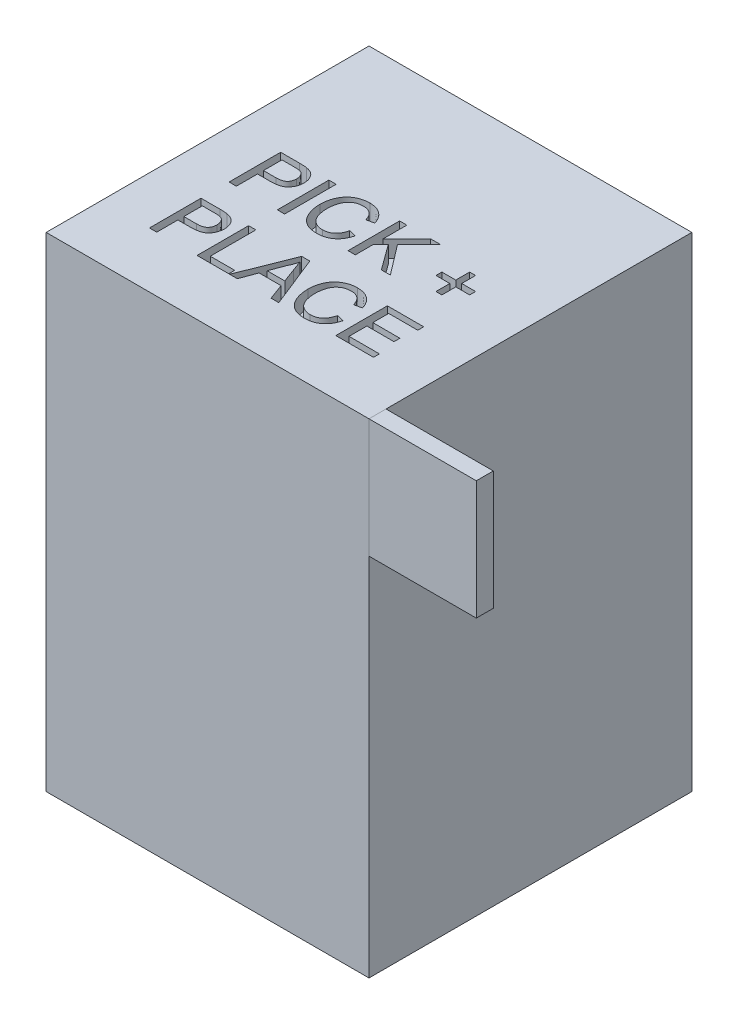
from build123d import *

# Parameters (mm, degrees)
SKETCH1_W           = 965.2
SKETCH1_H           = 965.2
BOSS_EXTRUDE1_DEPTH = 1447.8
SKETCH2_W           = 21.731927333
SKETCH2_H           = 154.099121094
CUT_EXTRUDE1_DEPTH  = 50.8
SKETCH3_W           = 50.8
SKETCH3_H           = 355.6
BOSS_EXTRUDE2_DEPTH = 320.802


with BuildPart() as part:
    # Sketch1 → Boss-Extrude1 (new body)
    with BuildSketch(Plane(origin=(0, 0, 0), x_dir=(1, 0, 0), z_dir=(0, 1, 0))):
        Rectangle(SKETCH1_W, SKETCH1_H)
    extrude(amount=BOSS_EXTRUDE1_DEPTH)

    # Sketch2 → Cut-Extrude1 (cut)
    # profile 1 of 10: a face of its own
    with BuildSketch(Plane(origin=(0, 1447.8, 0), x_dir=(1, 0, 0), z_dir=(0, 1, 0))):
        with BuildLine():
            Line((-339.627755427, -78.624535258), (-339.627755427, 75.474585836))
            Line((-339.627755427, 75.474585836), (-283.013615185, 75.474585836))
            add(Edge.make_bspline(
                [(-283.013615185, 75.474585836), (-280.667004704, 75.461217004), (-276.260059214, 75.436110275), (-270.105816457, 75.142078196), (-264.821068254, 74.778311845), (-261.629059109, 74.260403174), (-260.170396113, 74.023732733)],
                knots=[0, 0, 0, 0, 1.22865052, 2.30741144, 3.226532197, 4, 4, 4, 4], degree=3))
            add(Edge.make_bspline(
                [(-260.170396113, 74.023732733), (-258.391179385, 73.681318496), (-254.942561415, 73.017624258), (-250.059852894, 71.41760142), (-245.61142258, 69.426495139), (-241.604222517, 66.945782167), (-237.971680731, 64.031551212), (-234.765565087, 60.539618429), (-231.923585551, 56.547952525), (-229.507034816, 52.059676746), (-227.495626597, 47.230293933), (-226.086828435, 42.085330183), (-225.184490675, 36.714172238), (-225.08951363, 33.043399002), (-225.041229486, 31.177262364)],
                knots=[0, 0, 0, 0, 1.070909925, 2.075721949, 3.031861647, 3.947440733, 4.85625699, 5.777986723, 6.742441087, 7.747548058, 8.78749499, 9.830146138, 10.896896232, 12, 12, 12, 12], degree=3))
            add(Edge.make_bspline(
                [(-225.041229486, 31.177262364), (-225.075257318, 29.580596552), (-225.142208943, 26.439069099), (-225.717111925, 21.823711888), (-226.623858219, 17.383550595), (-227.976393279, 13.148969934), (-229.629903724, 9.070463497), (-231.713708962, 5.216816267), (-234.147005557, 1.535698965), (-236.938751888, -1.962871767), (-240.225412673, -5.207901957), (-244.179669639, -7.960672101), (-248.725284333, -10.272225205), (-253.863316931, -12.139935113), (-259.581294747, -13.609521844), (-265.897952926, -14.686267139), (-272.825596491, -15.28072015), (-277.641257972, -15.36210647), (-280.142778194, -15.404383014)],
                knots=[0, 0, 0, 0, 0.928769099, 1.82740408, 2.702266355, 3.562020322, 4.410419678, 5.259600434, 6.10654066, 6.975254961, 7.860221694, 8.783881459, 9.766664779, 10.81996744, 11.958551584, 13.197863772, 14.544415867, 16, 16, 16, 16], degree=3))
            Line((-280.142778194, -15.404383014), (-317.895828093, -15.404383014))
            Line((-317.895828093, -15.404383014), (-317.895828093, -78.624535258))
            Line((-317.895828093, -78.624535258), (-339.627755427, -78.624535258))
        make_face()
        with BuildLine():
            Line((-317.895828093, 2.376284804), (-280.729293278, 2.376284804))
            add(Edge.make_bspline(
                [(-280.729293278, 2.376284804), (-279.246945821, 2.401070217), (-276.391340822, 2.448817017), (-272.265121837, 2.782020128), (-268.478270976, 3.358779353), (-265.020283853, 4.163189613), (-261.886757326, 5.163048478), (-259.083297921, 6.427594734), (-256.6243622, 7.944489824), (-254.493656638, 9.698276451), (-252.66468637, 11.662945346), (-251.079927111, 13.806290672), (-249.733429983, 16.143629063), (-248.677935353, 18.684739731), (-247.78378588, 21.38019313), (-247.225675185, 24.285839229), (-246.837622573, 27.359541892), (-246.794946698, 29.478141928), (-246.773156819, 30.559878065)],
                knots=[0, 0, 0, 0, 1.403696362, 2.704090955, 3.91683431, 5.027708188, 6.063065288, 7.026749679, 7.932587242, 8.790956304, 9.632005367, 10.468072405, 11.310475089, 12.179234342, 13.069796908, 13.994719932, 14.976123913, 16, 16, 16, 16], degree=3))
            add(Edge.make_bspline(
                [(-246.773156819, 30.559878065), (-246.81919091, 32.128567993), (-246.908388905, 35.168141378), (-247.807080916, 39.541993877), (-249.21604013, 43.583511137), (-251.233255093, 47.216174503), (-253.674671953, 50.402987814), (-256.544505729, 53.010325668), (-259.750748759, 55.094796191), (-262.144682294, 55.920144865), (-263.349925254, 56.335672559)],
                knots=[0, 0, 0, 0, 1.143156811, 2.215038775, 3.243253804, 4.254666983, 5.233799895, 6.158487526, 7.072877374, 8, 8, 8, 8], degree=3))
            add(Edge.make_bspline(
                [(-263.349925254, 56.335672559), (-263.79132385, 56.443604269), (-264.750513348, 56.678147295), (-266.33940324, 56.944357165), (-268.180842911, 57.196434266), (-270.28380846, 57.36367569), (-272.629121366, 57.529767704), (-275.223951545, 57.606331985), (-278.074209951, 57.672461694), (-280.060407528, 57.686547399), (-281.099723858, 57.693918017)],
                knots=[0, 0, 0, 0, 0.611063981, 1.327884044, 2.165719042, 3.110592661, 4.16481496, 5.328235826, 6.601947678, 8, 8, 8, 8], degree=3))
            Line((-281.099723858, 57.693918017), (-317.895828093, 57.693918017))
            Line((-317.895828093, 57.693918017), (-317.895828093, 2.376284804))
        make_face(mode=Mode.SUBTRACT)
    # profile 2 of 10: a face of its own
    with BuildSketch(Plane(origin=(0, 1447.8, 0), x_dir=(1, 0, 0), z_dir=(0, 1, 0))):
        with Locations((-184.540819455, -1.574974711)):
            Rectangle(SKETCH2_W, SKETCH2_H)
    # profile 3 of 10: a face of its own
    with BuildSketch(Plane(origin=(0, 1447.8, 0), x_dir=(1, 0, 0), z_dir=(0, 1, 0))):
        with BuildLine():
            Line((-33.405142997, -24.232978494), (-11.673215663, -29.295529748))
            add(Edge.make_bspline(
                [(-11.673215663, -29.295529748), (-12.217661107, -31.332402926), (-13.282663967, -35.316779669), (-15.38830399, -41.018863833), (-17.751626685, -46.370026598), (-20.42997696, -51.356172049), (-23.452669114, -55.948632949), (-26.739614015, -60.206431278), (-30.421002924, -64.040276976), (-34.361761285, -67.538653203), (-38.592572201, -70.624211699), (-43.062426589, -73.288648066), (-47.749718135, -75.555542558), (-52.673391408, -77.419697395), (-57.836638471, -78.822633738), (-63.212873678, -79.845175936), (-68.817773778, -80.475002375), (-72.638265877, -80.557920878), (-74.584675757, -80.600165016)],
                knots=[0, 0, 0, 0, 1.145254194, 2.240259345, 3.299159039, 4.322497661, 5.312016644, 6.284080175, 7.241264552, 8.196044782, 9.144516039, 10.082428046, 11.020306713, 11.970622414, 12.939253955, 13.924100776, 14.94240044, 16, 16, 16, 16], degree=3))
            add(Edge.make_bspline(
                [(-74.584675757, -80.600165016), (-76.581729995, -80.571151403), (-80.488807024, -80.514388589), (-86.212449617, -80.052694943), (-91.656195758, -79.251959163), (-96.809879373, -78.139451395), (-101.69084715, -76.763904701), (-106.278859044, -75.03334507), (-110.565878996, -72.960259131), (-114.587666447, -70.602624647), (-118.327139496, -67.924245707), (-121.869335065, -64.997404478), (-125.128260424, -61.741528255), (-128.185401032, -58.233491295), (-130.974171256, -54.427017717), (-133.597170561, -50.373820064), (-135.926371862, -46.002481162), (-138.048093561, -41.394045748), (-139.910374046, -36.593131755), (-141.557840885, -31.694570495), (-142.904735091, -26.688601058), (-144.064324086, -21.617347805), (-144.906709304, -16.438139626), (-145.575537086, -11.189836433), (-145.943272047, -5.840261587), (-145.991662088, -2.24431643), (-146.016039181, -0.432813757)],
                knots=[0, 0, 0, 0, 1.180702053, 2.309949215, 3.392367133, 4.431746864, 5.425408375, 6.388154007, 7.326956194, 8.237882283, 9.141054626, 10.043899035, 10.951650021, 11.86168169, 12.792564695, 13.739356664, 14.713891418, 15.718426911, 16.737522708, 17.757217648, 18.772674716, 19.801476837, 20.831699174, 21.873853055, 22.928926693, 24, 24, 24, 24], degree=3))
            add(Edge.make_bspline(
                [(-146.016039181, -0.432813757), (-145.981174803, 1.522776426), (-145.912291598, 5.386528702), (-145.523447021, 11.087607339), (-144.809280478, 16.589845663), (-143.817510877, 21.896862928), (-142.562525568, 27.012957056), (-141.013386882, 31.940620586), (-139.189691359, 36.673548625), (-137.096998827, 41.216960174), (-134.721405809, 45.520138779), (-132.133814037, 49.589201758), (-129.272499511, 53.357336907), (-126.22229595, 56.896535485), (-122.907022477, 60.147865863), (-119.336802478, 63.118693066), (-115.542438293, 65.836114804), (-111.524483755, 68.274903628), (-107.335458209, 70.414813221), (-103.037582166, 72.320849342), (-98.613761147, 73.883105036), (-94.099068453, 75.182057844), (-89.483784361, 76.216144946), (-84.757124759, 76.907642216), (-79.923457156, 77.358275414), (-76.66422095, 77.419347033), (-75.016844767, 77.450215593)],
                knots=[0, 0, 0, 0, 1.185634383, 2.342514083, 3.462112933, 4.547331452, 5.613960142, 6.653690668, 7.676612054, 8.686959706, 9.683658101, 10.654407272, 11.607580201, 12.5494388, 13.484601218, 14.419076806, 15.362504069, 16.311442244, 17.265594461, 18.212500624, 19.159571152, 20.107257795, 21.059246075, 22.024387127, 23.001429356, 24, 24, 24, 24], degree=3))
            add(Edge.make_bspline(
                [(-75.016844767, 77.450215593), (-73.173652746, 77.415472336), (-69.550676326, 77.347181023), (-64.23460392, 76.785471502), (-59.14319455, 75.844669586), (-54.254386225, 74.610426443), (-49.619006971, 72.920490655), (-45.186731743, 70.91135123), (-41.001652904, 68.497613586), (-37.031206968, 65.745611596), (-33.3400267, 62.650269927), (-29.876457954, 59.285535443), (-26.781726868, 55.567314328), (-23.933263279, 51.585594159), (-21.420689348, 47.285162064), (-19.151570024, 42.703513194), (-17.200193447, 37.806588227), (-16.156109795, 34.395744539), (-15.624475179, 32.658984683)],
                knots=[0, 0, 0, 0, 1.098391872, 2.158997981, 3.181470371, 4.182549255, 5.160268219, 6.118029851, 7.079534476, 8.035645336, 8.993622929, 9.94770573, 10.909620999, 11.872786677, 12.862530088, 13.874594564, 14.917769567, 16, 16, 16, 16], degree=3))
            Line((-15.624475179, 32.658984683), (-37.356402512, 27.997733223))
            add(Edge.make_bspline(
                [(-37.356402512, 27.997733223), (-37.783183643, 29.330607241), (-38.618526369, 31.939454108), (-40.101759092, 35.657524534), (-41.70360098, 39.109108649), (-43.462209222, 42.270744138), (-45.38139509, 45.143188304), (-47.416964833, 47.761351437), (-49.617688662, 50.076365121), (-51.938802014, 52.141607815), (-54.440242852, 53.900996955), (-57.063366539, 55.460105271), (-59.863481607, 56.750029651), (-62.800306337, 57.841039202), (-65.901290919, 58.67141503), (-69.153807731, 59.255617181), (-72.560714511, 59.593724765), (-74.882330127, 59.643938049), (-76.066398076, 59.669547775)],
                knots=[0, 0, 0, 0, 1.235697765, 2.418642872, 3.532555292, 4.594392283, 5.610119701, 6.580908344, 7.519430642, 8.427315627, 9.319973334, 10.216139639, 11.118687699, 12.038725643, 12.980015607, 13.949697744, 14.954307006, 16, 16, 16, 16], degree=3))
            add(Edge.make_bspline(
                [(-76.066398076, 59.669547775), (-77.425816403, 59.649823965), (-80.099391077, 59.611033052), (-84.027193901, 59.186470812), (-87.799250762, 58.561132062), (-91.387448648, 57.623382849), (-94.811422436, 56.454253436), (-98.050853664, 54.998480455), (-101.133298377, 53.292143759), (-104.024354922, 51.324996589), (-106.699726584, 49.113544589), (-109.232015205, 46.775693813), (-111.499642837, 44.202412241), (-113.589080912, 41.478551159), (-115.439485066, 38.555977967), (-117.105158778, 35.474501652), (-118.575484649, 32.208867096), (-120.178239689, 27.612733805), (-121.81246327, 21.693020421), (-123.230154242, 14.449209925), (-124.133189968, 7.09127369), (-124.233698181, 2.142191678), (-124.284111847, -0.340206113)],
                knots=[0, 0, 0, 0, 0.935256702, 1.839373932, 2.716087708, 3.564631604, 4.388828665, 5.203538865, 6.005592122, 6.810952829, 7.606223804, 8.392839071, 9.180346482, 9.963639178, 10.753404291, 11.558266631, 12.372976832, 13.215232055, 14.905983541, 16.594894834, 18.292041732, 20, 20, 20, 20], degree=3))
            add(Edge.make_bspline(
                [(-124.284111847, -0.340206113), (-124.227252387, -3.461405905), (-124.116939885, -9.516816156), (-123.028426628, -18.292105841), (-121.368838899, -26.477089068), (-119.36595561, -32.863006836), (-117.356862432, -37.573380017), (-115.732008818, -40.872122288), (-113.877303239, -43.924618353), (-111.838878984, -46.748203712), (-109.590479008, -49.334642046), (-107.163428074, -51.6976727), (-104.557184047, -53.860033591), (-101.740865354, -55.720500676), (-98.822875642, -57.372433218), (-95.84003759, -58.841363181), (-92.79047317, -60.08371913), (-89.661878679, -61.048806463), (-86.498187952, -61.88277609), (-83.264556196, -62.427564193), (-79.961905517, -62.735025433), (-77.744257247, -62.791114183), (-76.622043945, -62.819497197)],
                knots=[0, 0, 0, 0, 2.10686522, 4.087509323, 5.961373225, 7.741398778, 8.594514555, 9.418024779, 10.222433421, 11.003575649, 11.767087398, 12.533660211, 13.289033706, 14.050297079, 14.809623433, 15.552362432, 16.294320901, 17.0305302, 17.761969017, 18.502233515, 19.242073914, 20, 20, 20, 20], degree=3))
            add(Edge.make_bspline(
                [(-76.622043945, -62.819497197), (-75.28283603, -62.79141119), (-72.637426869, -62.735931396), (-68.758921135, -62.250313634), (-65.020095076, -61.534692342), (-61.466244047, -60.430416428), (-58.049564733, -59.07835995), (-54.79805097, -57.411037852), (-51.721928264, -55.405736005), (-48.785014651, -53.128904117), (-46.041469413, -50.538258508), (-43.527157695, -47.654670675), (-41.271536006, -44.464994765), (-39.180007086, -41.020420419), (-37.42273839, -37.218045479), (-35.795092653, -33.171202004), (-34.438820647, -28.813376525), (-33.754651855, -25.781710522), (-33.405142997, -24.232978494)],
                knots=[0, 0, 0, 0, 1.013374089, 2.001772144, 2.95501459, 3.891367103, 4.814208647, 5.733921849, 6.652182523, 7.590185968, 8.54346024, 9.504121027, 10.481158517, 11.497760682, 12.549996529, 13.647863555, 14.798406869, 16, 16, 16, 16], degree=3))
        make_face()
    # profile 4 of 10: a face of its own
    with BuildSketch(Plane(origin=(0, 1447.8, 0), x_dir=(1, 0, 0), z_dir=(0, 1, 0))):
        Polygon((15.985600943, -78.624535258), (15.985600943, 75.474585836), (37.717528277, 75.474585836), (37.717528277, 4.475391422), (108.716722691, 75.474585836), (138.474645915, 75.474585836), (74.081463503, 11.081403424), (142.42590543, -78.624535258), (115.662296058, -78.624535258), (60.31379363, -2.717135665), (37.717528277, -25.282531802), (37.717528277, -78.624535258), align=None)
    # profile 5 of 10: a face of its own
    with BuildSketch(Plane(origin=(0, 1447.8, 0), x_dir=(1, 0, 0), z_dir=(0, 1, 0))):
        Polygon((253.061171857, -52.941348409), (253.061171857, -11.453123499), (211.572946947, -11.453123499), (211.572946947, 6.327544319), (253.061171857, 6.327544319), (253.061171857, 47.815769229), (270.841839675, 47.815769229), (270.841839675, 6.327544319), (312.330064585, 6.327544319), (312.330064585, -11.453123499), (270.841839675, -11.453123499), (270.841839675, -52.941348409), align=None)
    # profile 6 of 10: a face of its own
    with BuildSketch(Plane(origin=(0, 1447.8, 0), x_dir=(1, 0, 0), z_dir=(0, 1, 0))):
        with BuildLine():
            Line((-339.627755427, -316.700106171), (-339.627755427, -162.600985078))
            Line((-339.627755427, -162.600985078), (-283.013615185, -162.600985078))
            add(Edge.make_bspline(
                [(-283.013615185, -162.600985078), (-280.667004704, -162.61435391), (-276.260059214, -162.639460639), (-270.105816457, -162.933492717), (-264.821068254, -163.297259069), (-261.629059109, -163.81516774), (-260.170396113, -164.051838181)],
                knots=[0, 0, 0, 0, 1.22865052, 2.30741144, 3.226532197, 4, 4, 4, 4], degree=3))
            add(Edge.make_bspline(
                [(-260.170396113, -164.051838181), (-258.391179385, -164.394252417), (-254.942561415, -165.057946655), (-250.059852894, -166.657969493), (-245.61142258, -168.649075775), (-241.604222517, -171.129788746), (-237.971680731, -174.044019702), (-234.765565087, -177.535952485), (-231.923585551, -181.527618388), (-229.507034816, -186.015894167), (-227.495626597, -190.845276981), (-226.086828435, -195.990240731), (-225.184490675, -201.361398675), (-225.08951363, -205.032171912), (-225.041229486, -206.898308549)],
                knots=[0, 0, 0, 0, 1.070909925, 2.075721949, 3.031861647, 3.947440733, 4.85625699, 5.777986723, 6.742441087, 7.747548058, 8.78749499, 9.830146138, 10.896896232, 12, 12, 12, 12], degree=3))
            add(Edge.make_bspline(
                [(-225.041229486, -206.898308549), (-225.075257318, -208.494974362), (-225.142208943, -211.636501815), (-225.717111925, -216.251859026), (-226.623858219, -220.692020318), (-227.976393279, -224.926600979), (-229.629903724, -229.005107416), (-231.713708962, -232.858754647), (-234.147005557, -236.539871949), (-236.938751888, -240.03844268), (-240.225412673, -243.28347287), (-244.179669639, -246.036243014), (-248.725284333, -248.347796118), (-253.863316931, -250.215506026), (-259.581294747, -251.685092757), (-265.897952926, -252.761838053), (-272.825596491, -253.356291064), (-277.641257972, -253.437677384), (-280.142778194, -253.479953928)],
                knots=[0, 0, 0, 0, 0.928769099, 1.82740408, 2.702266355, 3.562020322, 4.410419678, 5.259600434, 6.10654066, 6.975254961, 7.860221694, 8.783881459, 9.766664779, 10.81996744, 11.958551584, 13.197863772, 14.544415867, 16, 16, 16, 16], degree=3))
            Line((-280.142778194, -253.479953928), (-317.895828093, -253.479953928))
            Line((-317.895828093, -253.479953928), (-317.895828093, -316.700106171))
            Line((-317.895828093, -316.700106171), (-339.627755427, -316.700106171))
        make_face()
        with BuildLine():
            Line((-317.895828093, -235.699286109), (-280.729293278, -235.699286109))
            add(Edge.make_bspline(
                [(-280.729293278, -235.699286109), (-279.246945821, -235.674500697), (-276.391340822, -235.626753896), (-272.265121837, -235.293550786), (-268.478270976, -234.716791561), (-265.020283853, -233.9123813), (-261.886757326, -232.912522436), (-259.083297921, -231.647976179), (-256.6243622, -230.131081089), (-254.493656638, -228.377294462), (-252.66468637, -226.412625567), (-251.079927111, -224.269280241), (-249.733429983, -221.931941851), (-248.677935353, -219.390831182), (-247.78378588, -216.695377784), (-247.225675185, -213.789731685), (-246.837622573, -210.716029022), (-246.794946698, -208.597428986), (-246.773156819, -207.515692848)],
                knots=[0, 0, 0, 0, 1.403696362, 2.704090955, 3.91683431, 5.027708188, 6.063065288, 7.026749679, 7.932587242, 8.790956304, 9.632005367, 10.468072405, 11.310475089, 12.179234342, 13.069796908, 13.994719932, 14.976123913, 16, 16, 16, 16], degree=3))
            add(Edge.make_bspline(
                [(-246.773156819, -207.515692848), (-246.81919091, -205.94700292), (-246.908388905, -202.907429536), (-247.807080916, -198.533577036), (-249.21604013, -194.492059777), (-251.233255093, -190.859396411), (-253.674671953, -187.672583099), (-256.544505729, -185.065245246), (-259.750748759, -182.980774723), (-262.144682294, -182.155426048), (-263.349925254, -181.739898355)],
                knots=[0, 0, 0, 0, 1.143156811, 2.215038775, 3.243253804, 4.254666983, 5.233799895, 6.158487526, 7.072877374, 8, 8, 8, 8], degree=3))
            add(Edge.make_bspline(
                [(-263.349925254, -181.739898355), (-263.79132385, -181.631966645), (-264.750513348, -181.397423618), (-266.33940324, -181.131213748), (-268.180842911, -180.879136647), (-270.28380846, -180.711895223), (-272.629121366, -180.54580321), (-275.223951545, -180.469238928), (-278.074209951, -180.403109219), (-280.060407528, -180.389023514), (-281.099723858, -180.381652896)],
                knots=[0, 0, 0, 0, 0.611063981, 1.327884044, 2.165719042, 3.110592661, 4.16481496, 5.328235826, 6.601947678, 8, 8, 8, 8], degree=3))
            Line((-281.099723858, -180.381652896), (-317.895828093, -180.381652896))
            Line((-317.895828093, -180.381652896), (-317.895828093, -235.699286109))
        make_face(mode=Mode.SUBTRACT)
    # profile 7 of 10: a face of its own
    with BuildSketch(Plane(origin=(0, 1447.8, 0), x_dir=(1, 0, 0), z_dir=(0, 1, 0))):
        Polygon((-197.382412879, -316.700106171), (-197.382412879, -162.600985078), (-175.650485545, -162.600985078), (-175.650485545, -298.919438353), (-102.552184514, -298.919438353), (-102.552184514, -316.700106171), align=None)
    # profile 8 of 10: a face of its own
    with BuildSketch(Plane(origin=(0, 1447.8, 0), x_dir=(1, 0, 0), z_dir=(0, 1, 0))):
        Polygon((-99.928301242, -316.700106171), (-38.745517186, -162.600985078), (-14.235360505, -162.600985078), (46.947423551, -316.700106171), (23.888119974, -316.700106171), (6.354405875, -269.284991989), (-59.335283566, -269.284991989), (-76.868997665, -316.700106171), align=None)
        with BuildLine():
            Line((-52.791009994, -251.50432417), (-0.189867697, -251.50432417))
            Line((-0.189867697, -251.50432417), (-15.161436954, -211.003914139))
            add(Edge.make_bspline(
                [(-15.161436954, -211.003914139), (-15.735393467, -209.439033489), (-16.85758682, -206.379396345), (-18.531115197, -201.934001862), (-20.060023755, -197.712472802), (-21.559244146, -193.775339847), (-22.912617172, -190.065412181), (-24.16005578, -186.607748687), (-25.393762037, -183.42638178), (-26.134126517, -181.370890956), (-26.490438846, -180.381652896)],
                knots=[0, 0, 0, 0, 1.225184869, 2.395467751, 3.491410812, 4.525364584, 5.492066482, 6.394148129, 7.227157926, 8, 8, 8, 8], degree=3))
            add(Edge.make_bspline(
                [(-26.490438846, -180.381652896), (-27.079848212, -182.821026837), (-28.261097263, -187.709833021), (-30.734345178, -194.872589924), (-33.563654893, -201.969840182), (-35.861391513, -206.5432598), (-37.016841148, -208.843069092)],
                knots=[0, 0, 0, 0, 0.9891762, 1.982431084, 2.985436691, 4, 4, 4, 4], degree=3))
            Line((-37.016841148, -208.843069092), (-52.791009994, -251.50432417))
        make_face(mode=Mode.SUBTRACT)
    # profile 9 of 10: a face of its own
    with BuildSketch(Plane(origin=(0, 1447.8, 0), x_dir=(1, 0, 0), z_dir=(0, 1, 0))):
        with BuildLine():
            Line((168.109092279, -262.308549407), (189.841019613, -267.371100661))
            add(Edge.make_bspline(
                [(189.841019613, -267.371100661), (189.29657417, -269.40797384), (188.231571309, -273.392350583), (186.125931286, -279.094434747), (183.762608592, -284.445597511), (181.084258316, -289.431742963), (178.061566163, -294.024203862), (174.774621261, -298.282002191), (171.093232352, -302.11584789), (167.152473992, -305.614224116), (162.921663076, -308.699782613), (158.451808687, -311.36421898), (153.764517142, -313.631113471), (148.840843868, -315.495268308), (143.677596806, -316.898204651), (138.301361598, -317.920746849), (132.696461498, -318.550573288), (128.8759694, -318.633491792), (126.929559519, -318.675735929)],
                knots=[0, 0, 0, 0, 1.145254194, 2.240259345, 3.299159039, 4.322497661, 5.312016644, 6.284080175, 7.241264552, 8.196044782, 9.144516039, 10.082428046, 11.020306713, 11.970622414, 12.939253955, 13.924100776, 14.94240044, 16, 16, 16, 16], degree=3))
            add(Edge.make_bspline(
                [(126.929559519, -318.675735929), (124.932505281, -318.646722317), (121.025428253, -318.589959503), (115.301785659, -318.128265856), (109.858039519, -317.327530076), (104.704355903, -316.215022308), (99.823388127, -314.839475614), (95.235376232, -313.108915984), (90.948356281, -311.035830045), (86.926568829, -308.678195561), (83.187095781, -305.99981662), (79.644900211, -303.072975391), (76.385974853, -299.817099168), (73.328834244, -296.309062209), (70.540064021, -292.502588631), (67.917064716, -288.449390977), (65.587863414, -284.078052076), (63.466141715, -279.469616661), (61.60386123, -274.668702668), (59.956394391, -269.770141409), (58.609500186, -264.764171971), (57.44991119, -259.692918718), (56.607525973, -254.51371054), (55.938698191, -249.265407347), (55.570963229, -243.915832501), (55.522573188, -240.319887343), (55.498196095, -238.508384671)],
                knots=[0, 0, 0, 0, 1.180702053, 2.309949215, 3.392367133, 4.431746864, 5.425408375, 6.388154007, 7.326956194, 8.237882283, 9.141054626, 10.043899035, 10.951650021, 11.86168169, 12.792564695, 13.739356664, 14.713891418, 15.718426911, 16.737522708, 17.757217648, 18.772674716, 19.801476837, 20.831699174, 21.873853055, 22.928926693, 24, 24, 24, 24], degree=3))
            add(Edge.make_bspline(
                [(55.498196095, -238.508384671), (55.533060473, -236.552794488), (55.601943679, -232.689042212), (55.990788256, -226.987963574), (56.704954799, -221.48572525), (57.696724399, -216.178707985), (58.951709708, -211.062613857), (60.500848394, -206.134950327), (62.324543918, -201.402022289), (64.41723645, -196.85861074), (66.792829467, -192.555432134), (69.380421239, -188.486369155), (72.241735765, -184.718234006), (75.291939326, -181.179035429), (78.6072128, -177.927705051), (82.177432799, -174.956877847), (85.971796984, -172.239456109), (89.989751522, -169.800667285), (94.178777067, -167.660757692), (98.47665311, -165.754721571), (102.90047413, -164.192465877), (107.415166824, -162.893513069), (112.030450916, -161.859425967), (116.757110518, -161.167928697), (121.59077812, -160.717295499), (124.850014326, -160.656223881), (126.49739051, -160.62535532)],
                knots=[0, 0, 0, 0, 1.185634383, 2.342514083, 3.462112933, 4.547331452, 5.613960142, 6.653690668, 7.676612054, 8.686959706, 9.683658101, 10.654407272, 11.607580201, 12.5494388, 13.484601218, 14.419076806, 15.362504069, 16.311442244, 17.265594461, 18.212500624, 19.159571152, 20.107257795, 21.059246075, 22.024387127, 23.001429356, 24, 24, 24, 24], degree=3))
            add(Edge.make_bspline(
                [(126.49739051, -160.62535532), (128.34058253, -160.660098578), (131.96355895, -160.728389891), (137.279631357, -161.290099411), (142.371040726, -162.230901327), (147.259849051, -163.465144471), (151.895228305, -165.155080259), (156.327503533, -167.164219683), (160.512582373, -169.577957328), (164.483028308, -172.329959318), (168.174208577, -175.425300987), (171.637777323, -178.79003547), (174.732508408, -182.508256585), (177.580971998, -186.489976754), (180.093545928, -190.790408849), (182.362665252, -195.37205772), (184.314041829, -200.268982686), (185.358125482, -203.679826374), (185.889760098, -205.416586231)],
                knots=[0, 0, 0, 0, 1.098391872, 2.158997981, 3.181470371, 4.182549255, 5.160268219, 6.118029851, 7.079534476, 8.035645336, 8.993622929, 9.94770573, 10.909620999, 11.872786677, 12.862530088, 13.874594564, 14.917769567, 16, 16, 16, 16], degree=3))
            Line((185.889760098, -205.416586231), (164.157832764, -210.07783769))
            add(Edge.make_bspline(
                [(164.157832764, -210.07783769), (163.731051633, -208.744963672), (162.895708907, -206.136116806), (161.412476184, -202.41804638), (159.810634297, -198.966462264), (158.052026055, -195.804826776), (156.132840186, -192.93238261), (154.097270443, -190.314219477), (151.896546615, -187.999205792), (149.575433262, -185.933963098), (147.073992424, -184.174573959), (144.450868737, -182.615465643), (141.65075367, -181.325541263), (138.713928939, -180.234531711), (135.612944357, -179.404155884), (132.360427545, -178.819953732), (128.953520766, -178.481846149), (126.631905149, -178.431632865), (125.447837201, -178.406023139)],
                knots=[0, 0, 0, 0, 1.235697765, 2.418642872, 3.532555292, 4.594392283, 5.610119701, 6.580908344, 7.519430642, 8.427315627, 9.319973334, 10.216139639, 11.118687699, 12.038725643, 12.980015607, 13.949697744, 14.954307006, 16, 16, 16, 16], degree=3))
            add(Edge.make_bspline(
                [(125.447837201, -178.406023139), (124.088418874, -178.425746948), (121.414844199, -178.464537861), (117.487041375, -178.889100101), (113.714984515, -179.514438851), (110.126786628, -180.452188065), (106.70281284, -181.621317477), (103.463381613, -183.077090459), (100.3809369, -184.783427154), (97.489880354, -186.750574325), (94.814508693, -188.962026325), (92.282220072, -191.2998771), (90.01459244, -193.873158672), (87.925154365, -196.597019755), (86.074750211, -199.519592946), (84.409076498, -202.601069261), (82.938750628, -205.866703817), (81.335995588, -210.462837109), (79.701772006, -216.382550493), (78.284081034, -223.626360989), (77.381045309, -230.984297224), (77.280537095, -235.933379236), (77.230123429, -238.415777026)],
                knots=[0, 0, 0, 0, 0.935256702, 1.839373932, 2.716087708, 3.564631604, 4.388828665, 5.203538865, 6.005592122, 6.810952829, 7.606223804, 8.392839071, 9.180346482, 9.963639178, 10.753404291, 11.558266631, 12.372976832, 13.215232055, 14.905983541, 16.594894834, 18.292041732, 20, 20, 20, 20], degree=3))
            add(Edge.make_bspline(
                [(77.230123429, -238.415777026), (77.286982889, -241.536976818), (77.397295391, -247.592387069), (78.485808649, -256.367676754), (80.145396377, -264.552659981), (82.148279667, -270.938577749), (84.157372844, -275.64895093), (85.782226458, -278.947693201), (87.636932037, -282.000189267), (89.675356293, -284.823774625), (91.923756269, -287.41021296), (94.350807202, -289.773243614), (96.95705123, -291.935604505), (99.773369923, -293.79607159), (102.691359635, -295.448004132), (105.674197687, -296.916934095), (108.723762106, -298.159290044), (111.852356597, -299.124377376), (115.016047325, -299.958347004), (118.249679081, -300.503135106), (121.55232976, -300.810596347), (123.76997803, -300.866685097), (124.892191332, -300.895068111)],
                knots=[0, 0, 0, 0, 2.10686522, 4.087509323, 5.961373225, 7.741398778, 8.594514555, 9.418024779, 10.222433421, 11.003575649, 11.767087398, 12.533660211, 13.289033706, 14.050297079, 14.809623433, 15.552362432, 16.294320901, 17.0305302, 17.761969017, 18.502233515, 19.242073914, 20, 20, 20, 20], degree=3))
            add(Edge.make_bspline(
                [(124.892191332, -300.895068111), (126.231399247, -300.866982104), (128.876808408, -300.811502309), (132.755314142, -300.325884547), (136.494140201, -299.610263256), (140.04799123, -298.505987341), (143.464670543, -297.153930863), (146.716184306, -295.486608765), (149.792307012, -293.481306919), (152.729220625, -291.204475031), (155.472765863, -288.613829421), (157.987077581, -285.730241589), (160.24269927, -282.540565678), (162.33422819, -279.095991333), (164.091496886, -275.293616392), (165.719142623, -271.246772917), (167.07541463, -266.888947439), (167.759583422, -263.857281435), (168.109092279, -262.308549407)],
                knots=[0, 0, 0, 0, 1.013374089, 2.001772144, 2.95501459, 3.891367103, 4.814208647, 5.733921849, 6.652182523, 7.590185968, 8.54346024, 9.504121027, 10.481158517, 11.497760682, 12.549996529, 13.647863555, 14.798406869, 16, 16, 16, 16], degree=3))
        make_face()
    # profile 10 of 10: a face of its own
    with BuildSketch(Plane(origin=(0, 1447.8, 0), x_dir=(1, 0, 0), z_dir=(0, 1, 0))):
        Polygon((217.49983622, -316.700106171), (217.49983622, -162.600985078), (326.159472888, -162.600985078), (326.159472888, -180.381652896), (239.231763553, -180.381652896), (239.231763553, -227.796767079), (320.232583615, -227.796767079), (320.232583615, -245.577434897), (239.231763553, -245.577434897), (239.231763553, -298.919438353), (330.110732403, -298.919438353), (330.110732403, -316.700106171), align=None)
    extrude(amount=-CUT_EXTRUDE1_DEPTH, mode=Mode.SUBTRACT)


with BuildPart() as body_2:
    # Sketch3 → Boss-Extrude2 (new body)
    with BuildSketch(Plane(origin=(482.6, 0, 0), x_dir=(0, 0, -1), z_dir=(1, 0, 0))):
        with Locations((-457.2, 1270)):
            Rectangle(SKETCH3_W, SKETCH3_H)
    extrude(amount=BOSS_EXTRUDE2_DEPTH)


solid = Compound([part.part, body_2.part])
